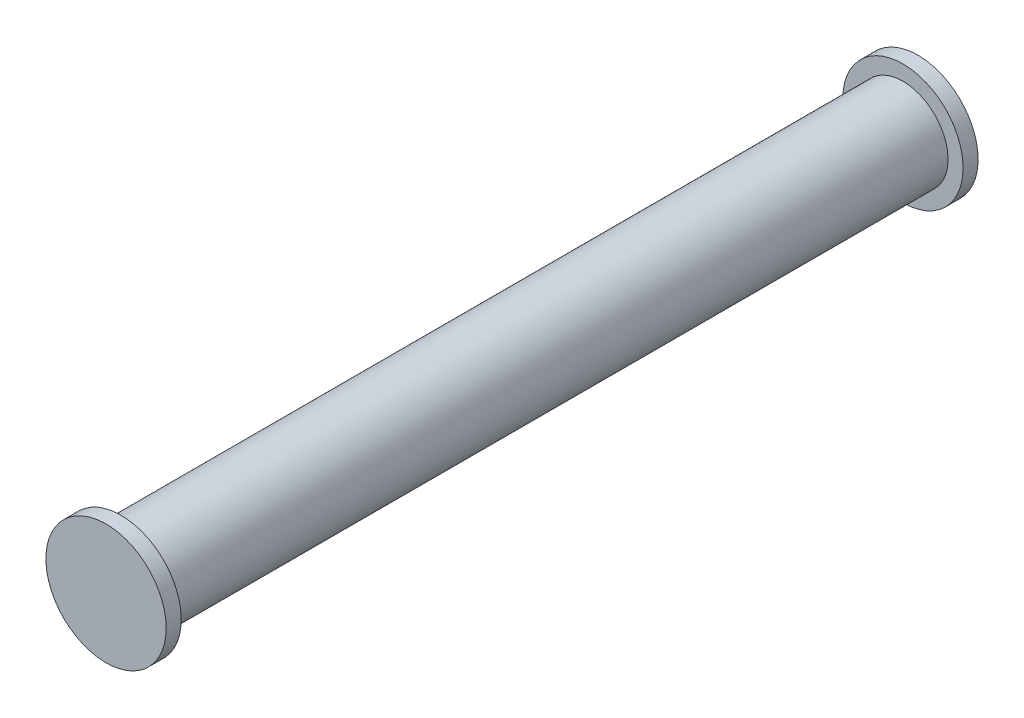
from build123d import *

# Parameters (mm, degrees)
ESQUISSE1_R        = 1.5
BOSS_EXTRU_1_DEPTH = 26
ESQUISSE2_R        = 2
BOSS_EXTRU_2_DEPTH = 0.5
BOSS_EXTRU_4_START = 0.5
ESQUISSE4_R        = 2
BOSS_EXTRU_4_DEPTH = 0.5


with BuildPart() as part:
    # Esquisse1 → Boss.-Extru.1 (new body)
    with BuildSketch(Plane.XY):
        with Locations(Location((0, 0, 0), (0, 0, 180))):
            Circle(ESQUISSE1_R)
    extrude(amount=BOSS_EXTRU_1_DEPTH)

    # Esquisse2 → Boss.-Extru.2 (add)
    with BuildSketch(Plane.XY.offset(26)):
        Circle(ESQUISSE2_R)
    extrude(amount=BOSS_EXTRU_2_DEPTH)

    # Esquisse4 → Boss.-Extru.4 (add)
    with BuildSketch(Plane(origin=(0, 0, 0), x_dir=(-1, 0, 0), z_dir=(0, 0, -1)).offset(BOSS_EXTRU_4_START)):
        with Locations(Location((0, 0, 0), (0, 0, 180))):
            Circle(ESQUISSE4_R)
    extrude(amount=-BOSS_EXTRU_4_DEPTH)


solid = part.part
